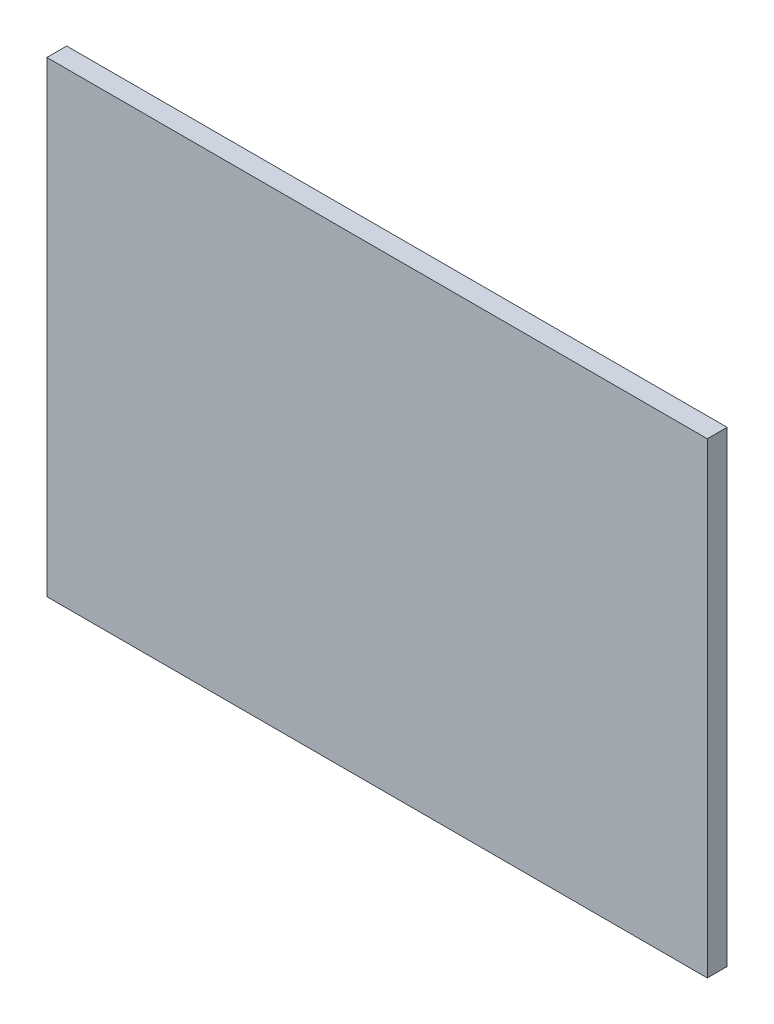
from build123d import *

# Parameters (mm, degrees)
SKETCH1_W           = 100
SKETCH1_H           = 70.707070707
BOSS_EXTRUDE1_DEPTH = 3


with BuildPart() as part:
    # Sketch1 → Boss-Extrude1 (new body)
    with BuildSketch(Plane.XY):
        with Locations((65, 75.353535354)):
            Rectangle(SKETCH1_W, SKETCH1_H)
    extrude(amount=BOSS_EXTRUDE1_DEPTH)


solid = part.part
